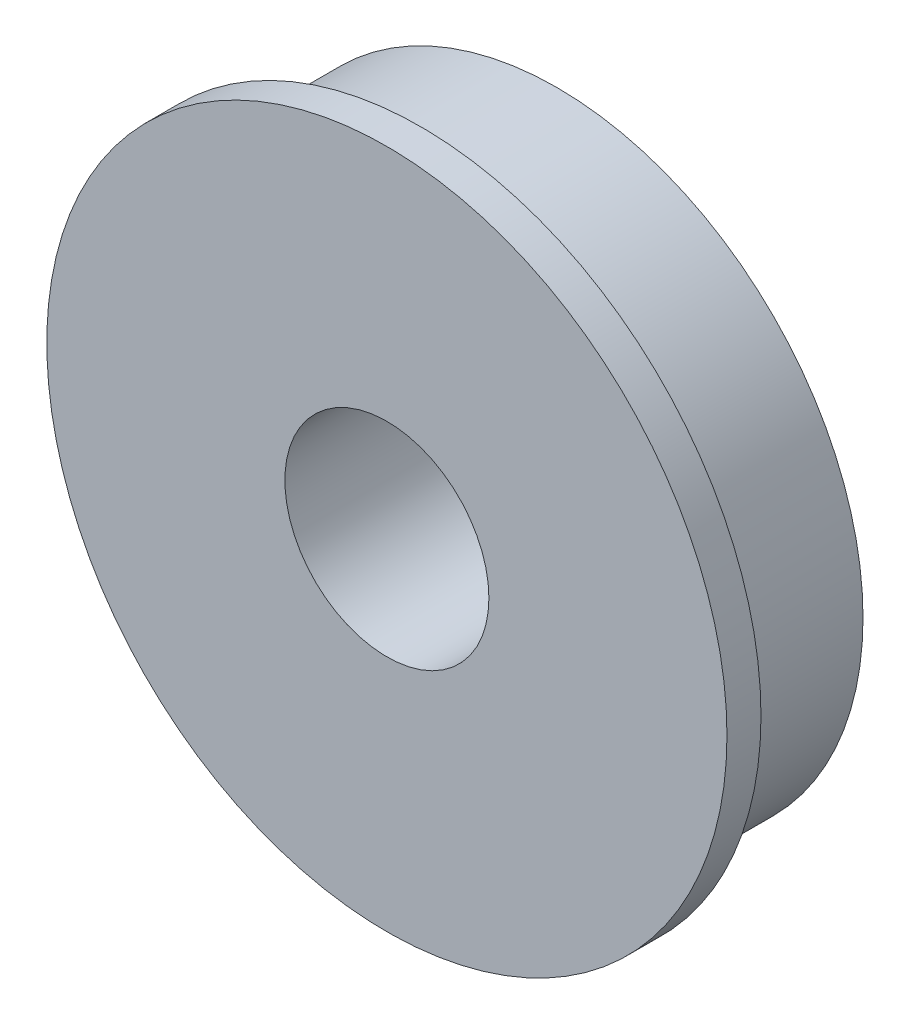
from build123d import *


with BuildPart() as part:
    # Sketch1 → Revolve1 (revolve)
    with BuildSketch(Plane(origin=(0, 0, 0), x_dir=(0, 0, -1), z_dir=(1, 0, 0)), mode=Mode.PRIVATE) as revolve1_sk:
        Polygon((0, 4.7625), (7.9375, 4.7625), (7.9375, 14.2875), (1.5875, 14.2875), (1.5875, 15.875), (0, 15.875), align=None)
    revolve(revolve1_sk.sketch.rotate(Axis((0, 0, 0), (0, 0, -1)), 90), axis=Axis((0, 0, 0), (0, 0, -1)))


solid = part.part
